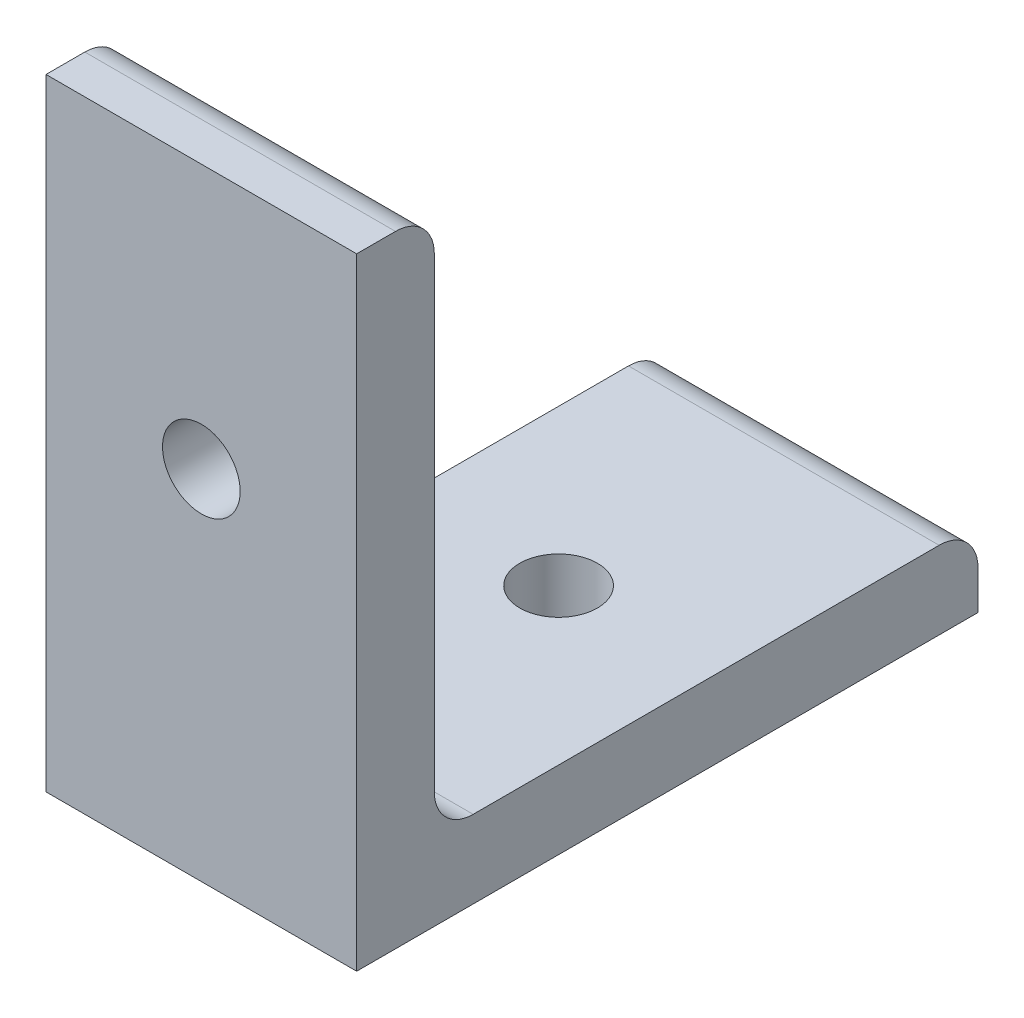
from build123d import *

# Parameters (mm, degrees)
BOSS_EXTRUDE1_DEPTH = 25.4
CUT_EXTRUDE1_REACH  = 78.2
SKETCH2_R           = 3.175
CUT_EXTRUDE2_REACH  = 74.122
SKETCH3_R           = 3.175
FILLET1_R           = 3.175
FILLET2_R           = 3.175


with BuildPart() as part:
    # Sketch1 → Boss-Extrude1 (new body)
    with BuildSketch(Plane(origin=(0, 0, 0), x_dir=(0, 0, -1), z_dir=(1, 0, 0))):
        Polygon((0, 0), (50.8, 0), (50.8, 6.35), (6.35, 6.35), (6.35, 50.8), (0, 50.8), align=None)
    extrude(amount=BOSS_EXTRUDE1_DEPTH)

    # Sketch2 → Cut-Extrude1 (cut, up to next)
    with BuildSketch(Plane.XY, mode=Mode.PRIVATE) as cut_extrude1_sk1:
        with Locations((12.7, 29.21)):
            Circle(SKETCH2_R)
    cut_extrude1_tool1 = extrude(cut_extrude1_sk1.sketch, amount=-CUT_EXTRUDE1_REACH, mode=Mode.PRIVATE) & part.part
    add(cut_extrude1_tool1.solids().sort_by_distance((12.7, 29.21, 0))[0], mode=Mode.SUBTRACT)

    # Sketch3 → Cut-Extrude2 (cut, up to next)
    with BuildSketch(Plane(origin=(0, 6.35, 0), x_dir=(1, 0, 0), z_dir=(0, 1, 0)), mode=Mode.PRIVATE) as cut_extrude2_sk1:
        with Locations(Location((12.7, 29.21, 0), (0, 0, 270))):
            Circle(SKETCH3_R)
    cut_extrude2_tool1 = extrude(cut_extrude2_sk1.sketch, amount=-CUT_EXTRUDE2_REACH, mode=Mode.PRIVATE) & part.part
    add(cut_extrude2_tool1.solids().sort_by_distance((12.7, 6.35, -29.21))[0], mode=Mode.SUBTRACT)

    # Fillet1
    fillet1_edges = [part.edges().sort_by_distance(p)[0] for p in [
        (12.7, 6.35, -6.35),
    ]]
    fillet(fillet1_edges, radius=FILLET1_R)

    # Fillet2
    fillet2_edges = [part.edges().sort_by_distance(p)[0] for p in [
        (12.7, 50.8, -6.35),
        (12.7, 6.35, -50.8),
    ]]
    fillet(fillet2_edges, radius=FILLET2_R)


solid = part.part
